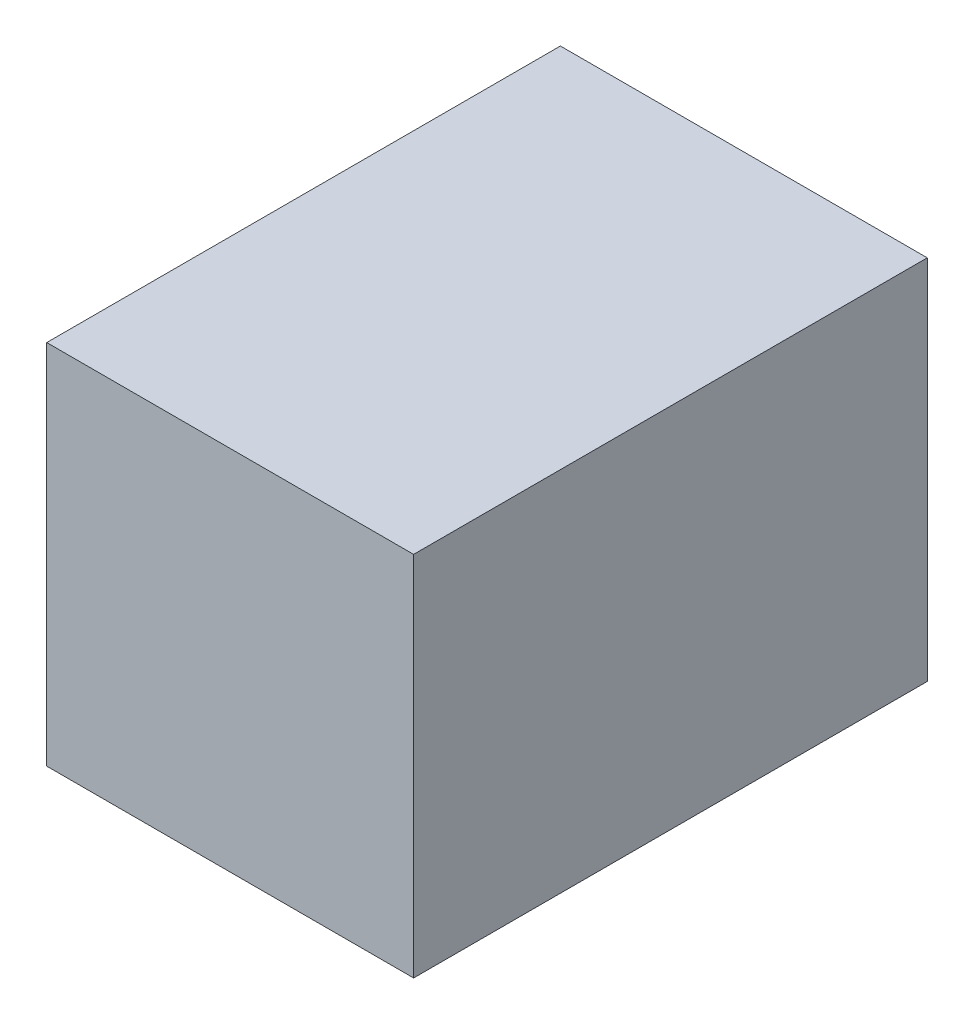
from build123d import *

# Parameters (mm, degrees)
OVEN_YAG_POMPASI_24V_1_START = -640
SKETCH1_W                    = 100
SKETCH1_H                    = 100
OVEN_YAG_POMPASI_24V_1_DEPTH = 140


with BuildPart() as part:
    # Sketch1 → OVEN_yag_pompasi_24V_1 (new body)
    with BuildSketch(Plane.XY.offset(OVEN_YAG_POMPASI_24V_1_START)):
        with Locations((110, 950)):
            Rectangle(SKETCH1_W, SKETCH1_H)
    extrude(amount=-OVEN_YAG_POMPASI_24V_1_DEPTH)


solid = part.part
